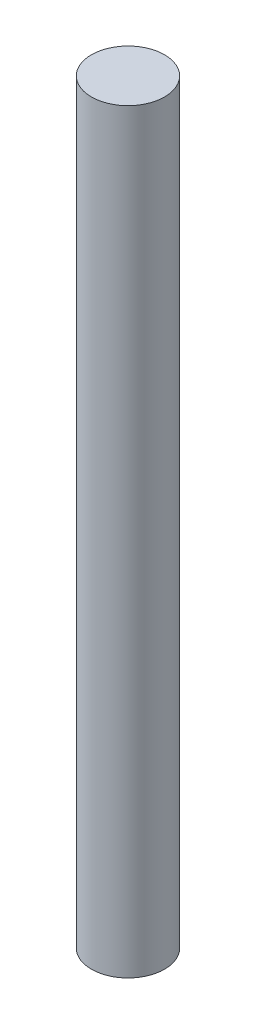
from build123d import *

# Parameters (mm, degrees)
SKETCH1_R           = 3
BOSS_EXTRUDE1_DEPTH = 62


with BuildPart() as part:
    # Sketch1 → Boss-Extrude1 (new body)
    with BuildSketch(Plane(origin=(0, 0, 0), x_dir=(1, 0, 0), z_dir=(0, 1, 0))):
        with Locations(Location((0, 0, 0), (0, 0, 270))):
            Circle(SKETCH1_R)
    extrude(amount=BOSS_EXTRUDE1_DEPTH)


solid = part.part
